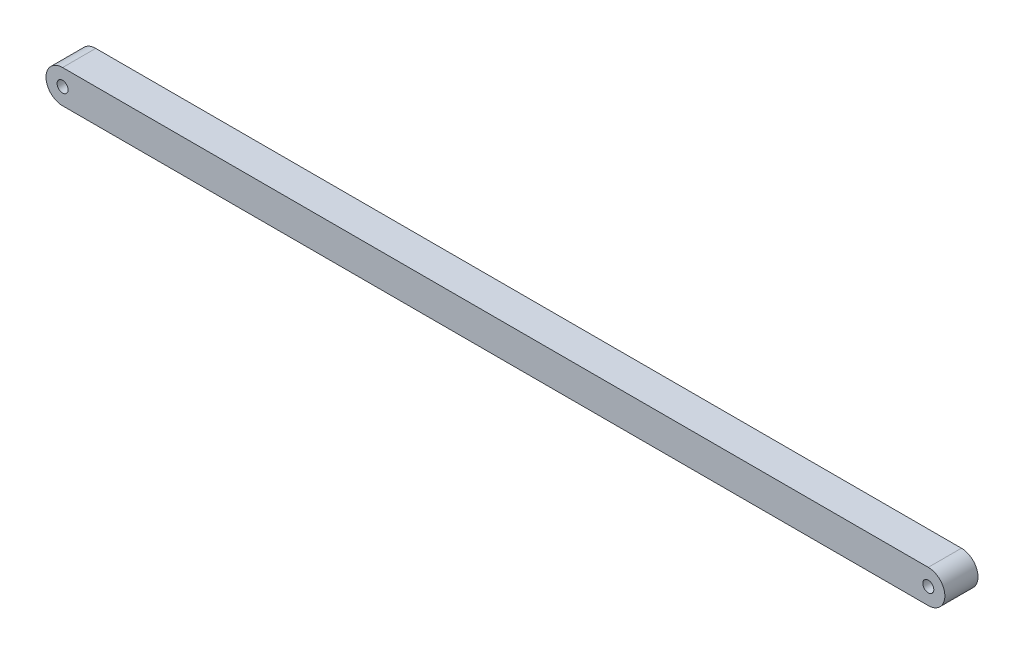
from build123d import *

# Parameters (mm, degrees)
SKETCH1_R           = 1.5
BOSS_EXTRUDE1_DEPTH = 9


with BuildPart() as part:
    # Sketch1 → Boss-Extrude1 (new body)
    with BuildSketch(Plane.XY):
        with BuildLine():
            Line((0, 4.5), (235, 4.5))
            ThreePointArc((235, 4.5), (239.5, 0), (235, -4.5))
            Line((235, -4.5), (0, -4.5))
            ThreePointArc((0, -4.5), (-4.5, 0), (0, 4.5))
        make_face()
        Circle(SKETCH1_R, mode=Mode.SUBTRACT)
        with Locations((235, 0)):
            Circle(SKETCH1_R, mode=Mode.SUBTRACT)
    extrude(amount=BOSS_EXTRUDE1_DEPTH)


solid = part.part
